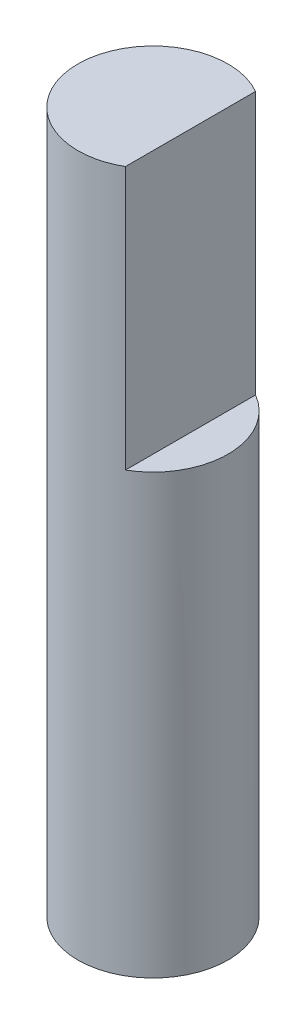
from build123d import *

# Parameters (mm, degrees)
BOSS_EXTRUDE1_DEPTH      = 18
BOSS_EXTRUDE1_DEPTH_BACK = 10
SKETCH1_R                = 3
SKETCH2_W                = 1.5
SKETCH2_H                = 6
CUT_EXTRUDE1_DEPTH       = 10.5


with BuildPart() as part:
    # Sketch1 → Boss-Extrude1 (new, two sides: drawn at the far end of the back side and taken through both)
    with BuildSketch(Plane(origin=(0, 0, 0), x_dir=(1, 0, 0), z_dir=(0, 1, 0)).offset(-BOSS_EXTRUDE1_DEPTH_BACK)):
        with Locations(Location((0, 0, 0), (0, 0, 270))):
            Circle(SKETCH1_R)
    extrude(amount=BOSS_EXTRUDE1_DEPTH + BOSS_EXTRUDE1_DEPTH_BACK)

    # Sketch2 → Cut-Extrude1 (cut)
    with BuildSketch(Plane(origin=(0, 18, 0), x_dir=(1, 0, 0), z_dir=(0, 1, 0))):
        with Locations((2.25, 0)):
            Rectangle(SKETCH2_W, SKETCH2_H)
    extrude(amount=-CUT_EXTRUDE1_DEPTH, mode=Mode.SUBTRACT)


solid = part.part
